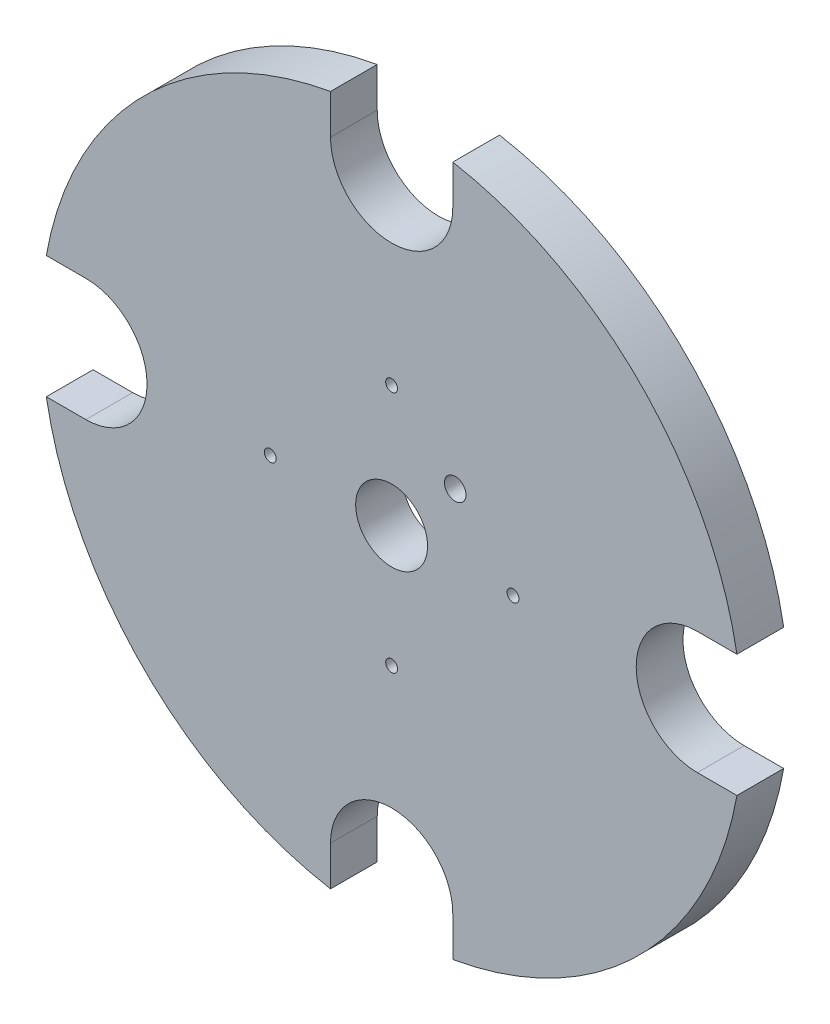
from build123d import *

# Parameters (mm, degrees)
ESQUISSE1_R             = 195
ESQUISSE1_R_2           = 20
BASE_EXTRUSION_DEPTH    = 26
ENL_V_MAT_EXTRU_1_DEPTH = 277.994584785
PER_AGE1_D              = 6.6
ESQUISSE5_R             = 6
ENL_V_MAT_EXTRU_2_DEPTH = 273.789295978
ESQUISSE6_R             = 18
ENL_V_MAT_EXTRU_3_DEPTH = 14


with BuildPart() as part:
    # Esquisse1 → Base-Extrusion (new body)
    with BuildSketch(Plane.XY):
        Circle(ESQUISSE1_R)
        with Locations(Location((0, 0, 0), (0, 0, 180))):
            Circle(ESQUISSE1_R_2, mode=Mode.SUBTRACT)
    extrude(amount=BASE_EXTRUSION_DEPTH)

    # Esquisse2 → Enlèv. mat.-Extru.1 (cut, through all)
    with BuildSketch(Plane.XY.offset(26)):
        with BuildLine():
            Line((170, 34), (192.013020392, 34))
            ThreePointArc((192.013020392, 34), (195, 0), (192.013020392, -34))
            Line((192.013020392, -34), (170, -34))
            ThreePointArc((170, -34), (136, 0), (170, 34))
        make_face()
        with BuildLine():
            Line((34, -170), (34, -192.013020392))
            ThreePointArc((34, -192.013020392), (0, -195), (-34, -192.013020392))
            Line((-34, -192.013020392), (-34, -170))
            ThreePointArc((-34, -170), (0, -136), (34, -170))
        make_face()
        with BuildLine():
            Line((-170, -34), (-192.013020392, -34))
            ThreePointArc((-192.013020392, -34), (-195, 0), (-192.013020392, 34))
            Line((-192.013020392, 34), (-170, 34))
            ThreePointArc((-170, 34), (-136, 0), (-170, -34))
        make_face()
        with BuildLine():
            Line((-34, 170), (-34, 192.013020392))
            ThreePointArc((-34, 192.013020392), (0, 195), (34, 192.013020392))
            Line((34, 192.013020392), (34, 170))
            ThreePointArc((34, 170), (0, 136), (-34, 170))
        make_face()
    extrude(amount=-ENL_V_MAT_EXTRU_1_DEPTH, mode=Mode.SUBTRACT)

    # Perçage1 (through all)
    with Locations(Plane.XY.offset(26)):
        with Locations((0, 67.5), (67.5, 0), (0, -67.5), (-67.5, 0)):
            Hole(PER_AGE1_D / 2)

    # Esquisse5 → Enlèv. mat.-Extru.2 (cut, through all)
    with BuildSketch(Plane.XY.offset(26)):
        with Locations((35.355339059, 35.355339059)):
            Circle(ESQUISSE5_R)
    extrude(amount=-ENL_V_MAT_EXTRU_2_DEPTH, mode=Mode.SUBTRACT)

    # Esquisse6 → Enlèv. mat.-Extru.3 (cut)
    with BuildSketch(Plane(origin=(0, 0, 0), x_dir=(-1, 0, 0), z_dir=(0, 0, -1))):
        with Locations((-35.355339059, 35.355339059)):
            Circle(ESQUISSE6_R)
    extrude(amount=-ENL_V_MAT_EXTRU_3_DEPTH, mode=Mode.SUBTRACT)


solid = part.part
